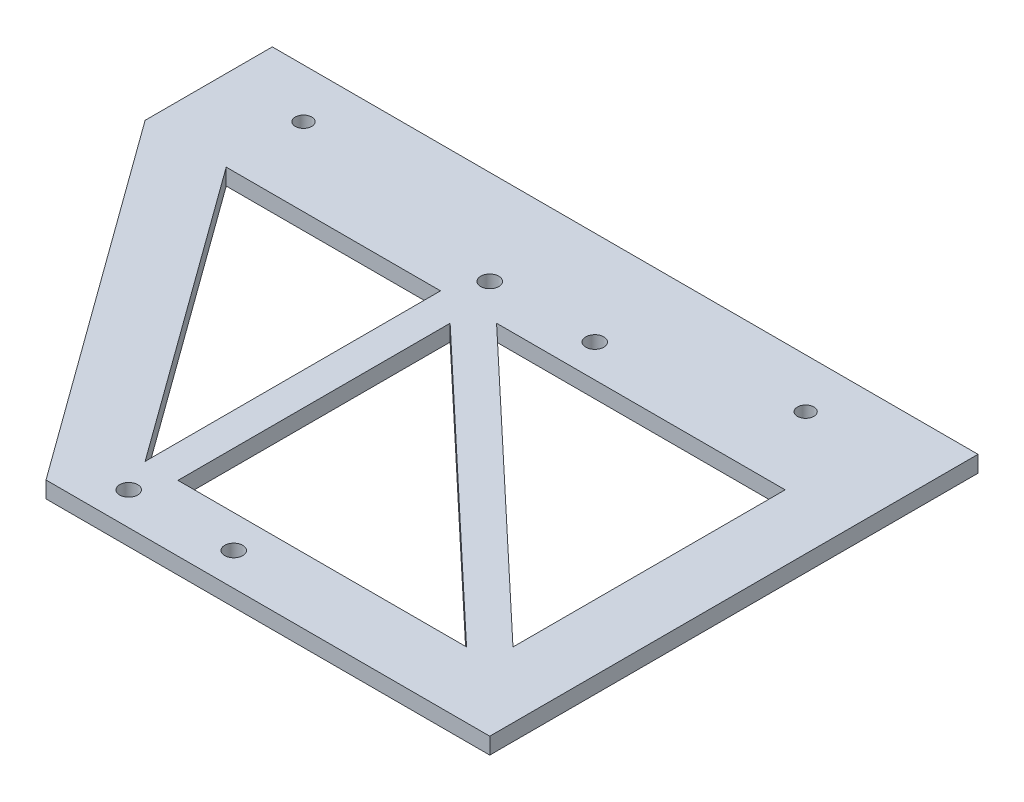
from build123d import *

# Parameters (mm, degrees)
SKETCH1_R           = 2.75
SKETCH1_R_2         = 2.5
BOSS_EXTRUDE2_DEPTH = 5


with BuildPart() as part:
    # Sketch1 → Boss-Extrude2 (new body)
    with BuildSketch(Plane(origin=(0, 0, 0), x_dir=(1, 0, 0), z_dir=(0, 1, 0))):
        Polygon((135.199443114, 0), (0, 0), (-79.800556886, 110), (-79.800556886, 148.75), (135.199443114, 148.75), align=None)
        with Locations(Location((15.199443114, 10, 0), (0, 0, 270))):
            Circle(SKETCH1_R, mode=Mode.SUBTRACT)
        with Locations(Location((47.199443114, 10, 0), (0, 0, 270))):
            Circle(SKETCH1_R, mode=Mode.SUBTRACT)
        with Locations(Location((15.199443114, 120, 0), (0, 0, 270))):
            Circle(SKETCH1_R, mode=Mode.SUBTRACT)
        with Locations(Location((47.199443114, 120, 0), (0, 0, 270))):
            Circle(SKETCH1_R, mode=Mode.SUBTRACT)
        with Locations(Location((-55.300556886, 133.75, 0), (0, 0, 270))):
            Circle(SKETCH1_R_2, mode=Mode.SUBTRACT)
        with Locations(Location((97.699443114, 133.75, 0), (0, 0, 270))):
            Circle(SKETCH1_R_2, mode=Mode.SUBTRACT)
        Polygon((20.199443114, 102.925904836), (108.125347951, 20), (20.199443114, 20), align=None, mode=Mode.SUBTRACT)
        Polygon((27.273538278, 110), (115.199443114, 27.074095164), (115.199443114, 110), align=None, mode=Mode.SUBTRACT)
        Polygon((-55.091921611, 110), (10.199443114, 20), (10.199443114, 110), align=None, mode=Mode.SUBTRACT)
    extrude(amount=BOSS_EXTRUDE2_DEPTH)


solid = part.part
